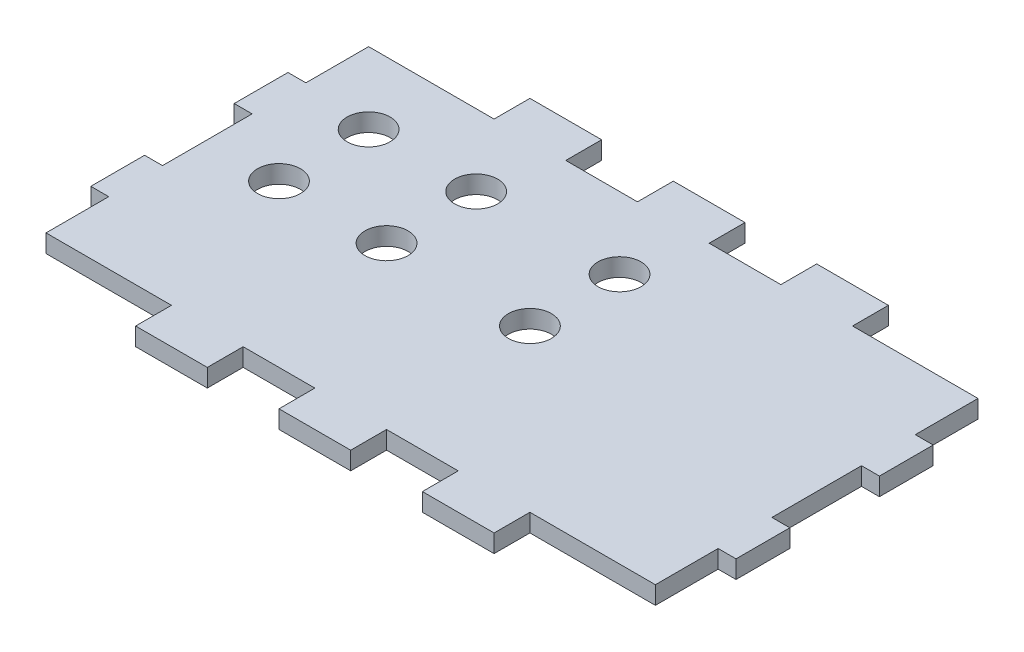
from build123d import *

# Parameters (mm, degrees)
ESQUISSE1_W             = 180
ESQUISSE1_H             = 110
BOSS_EXTRU_1_DEPTH      = 5
ESQUISSE2_W             = 20
ESQUISSE2_H             = 10
ESQUISSE2_W_2           = 5
ESQUISSE2_H_2           = 25
ENL_V_MAT_EXTRU_1_DEPTH = 5
ESQUISSE3_R             = 6
ENL_V_MAT_EXTRU_2_DEPTH = 5


with BuildPart() as part:
    # Esquisse1 → Boss.-Extru.1 (new body)
    with BuildSketch(Plane(origin=(0, 0, 0), x_dir=(1, 0, 0), z_dir=(0, 1, 0))):
        Rectangle(ESQUISSE1_W, ESQUISSE1_H)
    extrude(amount=BOSS_EXTRU_1_DEPTH)

    # Esquisse2 → Enlèv. mat.-Extru.1 (cut)
    with BuildSketch(Plane(origin=(0, 5, 0), x_dir=(1, 0, 0), z_dir=(0, 1, 0))):
        Polygon((-90, 55), (-90, 27.5), (-85, 27.5), (-85, 45), (-50, 45), (-50, 55), align=None)
        Polygon((85, 27.5), (90, 27.5), (90, 55), (50, 55), (50, 45), (85, 45), align=None)
        with Locations((20, 50)):
            Rectangle(ESQUISSE2_W, ESQUISSE2_H)
        with Locations((-20, 50)):
            Rectangle(ESQUISSE2_W, ESQUISSE2_H)
        with Locations((-87.5, 0)):
            Rectangle(ESQUISSE2_W_2, ESQUISSE2_H_2)
        Polygon((-90, -55), (-50, -55), (-50, -45), (-85, -45), (-85, -27.5), (-90, -27.5), align=None)
        Polygon((50, -45), (50, -55), (90, -55), (90, -27.5), (85, -27.5), (85, -45), align=None)
        with Locations((87.5, 0)):
            Rectangle(ESQUISSE2_W_2, ESQUISSE2_H_2)
        with Locations((20, -50)):
            Rectangle(ESQUISSE2_W, ESQUISSE2_H)
        with Locations((-20, -50)):
            Rectangle(ESQUISSE2_W, ESQUISSE2_H)
    extrude(amount=-ENL_V_MAT_EXTRU_1_DEPTH, mode=Mode.SUBTRACT)

    # Esquisse3 → Enlèv. mat.-Extru.2 (cut)
    with BuildSketch(Plane(origin=(0, 5, 0), x_dir=(1, 0, 0), z_dir=(0, 1, 0))):
        with Locations(Location((-35, 25, 0), (0, 0, 270))):
            Circle(ESQUISSE3_R)
        with Locations(Location((-35, 0, 0), (0, 0, 270))):
            Circle(ESQUISSE3_R)
        with Locations(Location((5, 25, 0), (0, 0, 270))):
            Circle(ESQUISSE3_R)
        with Locations(Location((5, 0, 0), (0, 0, 270))):
            Circle(ESQUISSE3_R)
        with Locations(Location((-65, 25, 0), (0, 0, 270))):
            Circle(ESQUISSE3_R)
        with Locations(Location((-65, 0, 0), (0, 0, 270))):
            Circle(ESQUISSE3_R)
    extrude(amount=-ENL_V_MAT_EXTRU_2_DEPTH, mode=Mode.SUBTRACT)


solid = part.part
